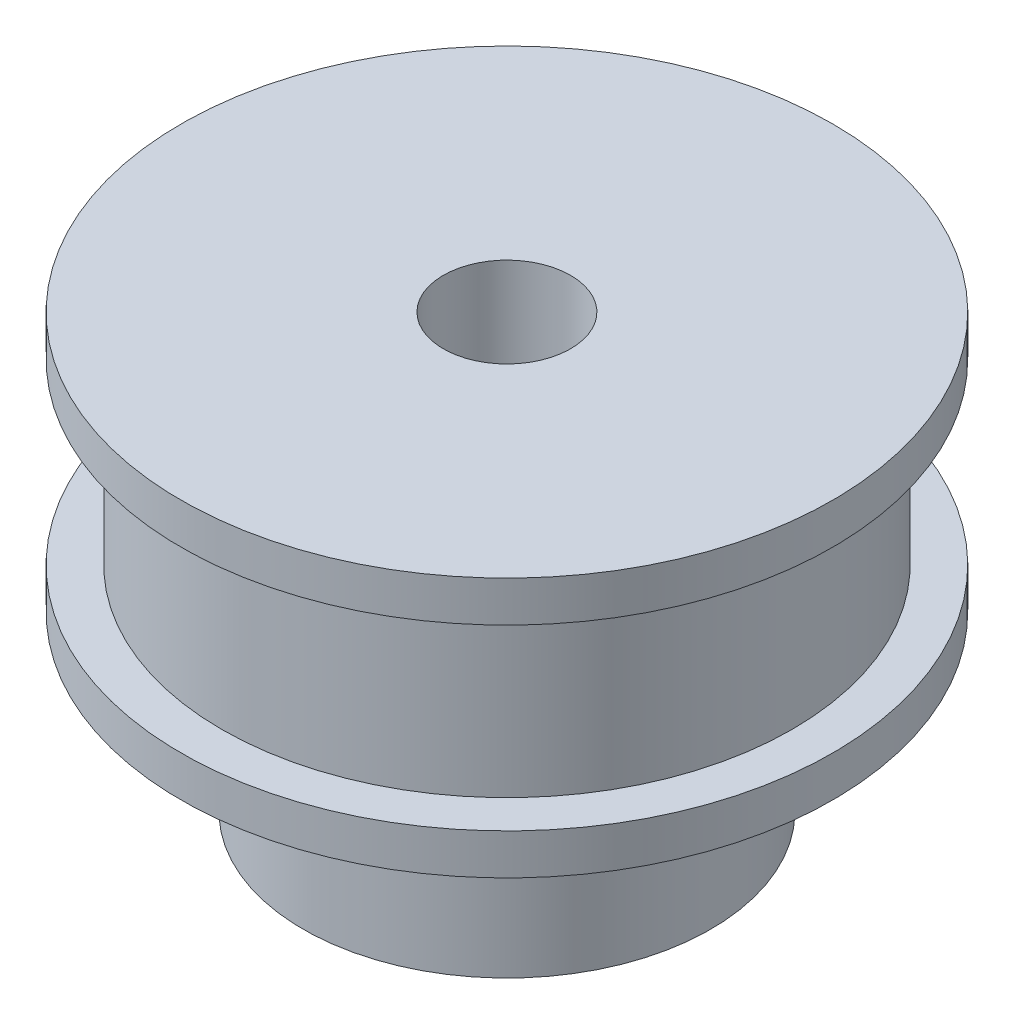
from build123d import *


with BuildPart() as part:
    # Sketch1 → Revolve1 (revolve)
    with BuildSketch(Plane.XY, mode=Mode.PRIVATE) as revolve1_sk:
        Polygon((8, 0), (8, 6.8), (12.8, 6.8), (12.8, 8.4), (11.2, 8.4), (11.2, 15.4), (12.8, 15.4), (12.8, 17), (2.5, 17), (2.5, 0), align=None)
    revolve(revolve1_sk.sketch.rotate(Axis((0, 0, 0), (0, 1, 0)), 90), axis=Axis((0, 0, 0), (0, 1, 0)))


solid = part.part
